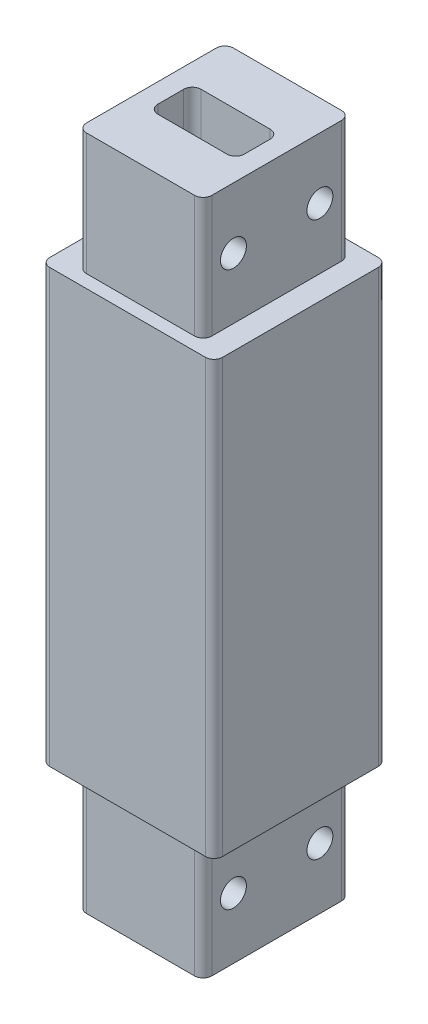
from build123d import *

# Parameters (mm, degrees)
SKETCH1_W             = 20
SKETCH1_H             = 20
BOSS_EXTRUDE1_DEPTH   = 50
BOSS_EXTRUDE2_DEPTH   = 39.1
CUT_EXTRUDE1_DEPTH    = 14.1
CUT_EXTRUDE2_START    = -14.1
CUT_EXTRUDE2_DEPTH    = 14.1
M3X0_5_TAPPED_HOLE1_D = 3
FILLET1_R             = 1


with BuildPart() as part:
    # Sketch1 → Boss-Extrude1 (new body)
    with BuildSketch(Plane(origin=(0, 0, 0), x_dir=(1, 0, 0), z_dir=(0, 1, 0))):
        Rectangle(SKETCH1_W, SKETCH1_H)
    extrude(amount=BOSS_EXTRUDE1_DEPTH)

    # Sketch2 → Boss-Extrude2 (add, symmetric)
    with BuildSketch(Plane(origin=(0, 25, 0), x_dir=(1, 0, 0), z_dir=(0, 1, 0))):
        with BuildLine():
            Line((-6.25, -8.5), (6.25, -8.5))
            ThreePointArc((6.25, -8.5), (6.957106781, -8.207106781), (7.25, -7.5))
            Line((7.25, -7.5), (7.25, 7.5))
            ThreePointArc((7.25, 7.5), (6.957106781, 8.207106781), (6.25, 8.5))
            Line((6.25, 8.5), (-6.25, 8.5))
            ThreePointArc((-6.25, 8.5), (-6.957106781, 8.207106781), (-7.25, 7.5))
            Line((-7.25, 7.5), (-7.25, -7.5))
            ThreePointArc((-7.25, -7.5), (-6.957106781, -8.207106781), (-6.25, -8.5))
        make_face()
    extrude(amount=BOSS_EXTRUDE2_DEPTH, both=True)

    # Sketch3 → Cut-Extrude1 (cut)
    with BuildSketch(Plane(origin=(0, 64.1, 0), x_dir=(1, 0, 0), z_dir=(0, 1, 0))):
        with BuildLine():
            Line((-4, -2.5), (4, -2.5))
            ThreePointArc((4, -2.5), (4.707106781, -2.207106781), (5, -1.5))
            Line((5, -1.5), (5, 1.5))
            ThreePointArc((5, 1.5), (4.707106781, 2.207106781), (4, 2.5))
            Line((4, 2.5), (-4, 2.5))
            ThreePointArc((-4, 2.5), (-4.707106781, 2.207106781), (-5, 1.5))
            Line((-5, 1.5), (-5, -1.5))
            ThreePointArc((-5, -1.5), (-4.707106781, -2.207106781), (-4, -2.5))
        make_face()
    extrude(amount=-CUT_EXTRUDE1_DEPTH, mode=Mode.SUBTRACT)

    # Sketch4 → Cut-Extrude2 (cut)
    with BuildSketch(Plane.XZ.offset(14.1).offset(CUT_EXTRUDE2_START)):
        with BuildLine():
            Line((-4, -2.5), (4, -2.5))
            ThreePointArc((4, -2.5), (4.707106781, -2.207106781), (5, -1.5))
            Line((5, -1.5), (5, 1.5))
            ThreePointArc((5, 1.5), (4.707106781, 2.207106781), (4, 2.5))
            Line((4, 2.5), (-4, 2.5))
            ThreePointArc((-4, 2.5), (-4.707106781, 2.207106781), (-5, 1.5))
            Line((-5, 1.5), (-5, -1.5))
            ThreePointArc((-5, -1.5), (-4.707106781, -2.207106781), (-4, -2.5))
        make_face()
    extrude(amount=CUT_EXTRUDE2_DEPTH, mode=Mode.SUBTRACT)

    # M3x0.5 Tapped Hole1 (through all)
    with Locations(Plane(origin=(7.25, 0, 0), x_dir=(0, 0, -1), z_dir=(1, 0, 0))):
        with Locations((5, 57.05), (5, -7.05), (-5, 57.05), (-5, -7.05)):
            Hole(M3X0_5_TAPPED_HOLE1_D / 2)

    # Fillet1
    fillet1_edges = [part.edges().sort_by_distance(p)[0] for p in [
        (10, 25, 10),
        (-10, 25, 10),
        (-10, 25, -10),
        (10, 25, -10),
    ]]
    fillet(fillet1_edges, radius=FILLET1_R)


solid = part.part
